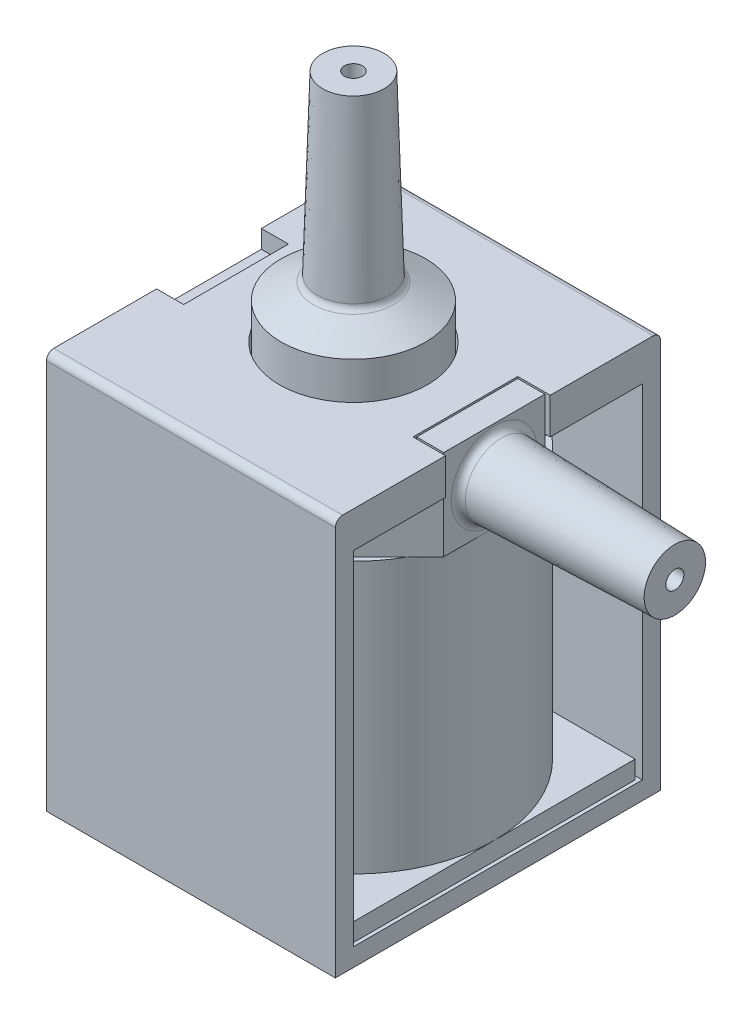
from build123d import *

# Parameters (mm, degrees)
SKETCH_1_W          = 16
SKETCH_1_H          = 18
EXTRUDE_1_DEPTH     = 1
SKETCH_2_W          = 15.6
SKETCH_2_H          = 15.6
EXTRUDE_2_DEPTH     = 1
SKETCH_3_R          = 7.8
EXTRUDE_3_DEPTH     = 15
EXTRUDE_4_DEPTH     = 3
SKETCH_5_R          = 4
EXTRUDE_5_DEPTH     = 4
SKETCH_7_R          = 0.5
CUT_EXTRUDE_1_DEPTH = 15
SKETCH_8_W          = 1.5
SKETCH_8_H          = 5.6
EXTRUDE_6_DEPTH     = 2
SKETCH_9_R          = 2
SKETCH_10_R         = 1.7
SKETCH_11_R         = 0.5
CUT_EXTRUDE_2_DEPTH = 11
SKETCH_12_W         = 16
SKETCH_12_H         = 1
EXTRUDE_7_DEPTH     = 19
SKETCH_13_R         = 4.1
EXTRUDE_8_DEPTH     = 2
SKETCH_14_W         = 1.5
SKETCH_14_H         = 5.8
CUT_EXTRUDE_3_DEPTH = 1
FILLET_1_R          = 0.4
FILLET_2_R          = 0.4


with BuildPart() as part:
    # 草图1 → 凸台-拉伸1 (new body)
    with BuildSketch(Plane(origin=(0, 0, 0), x_dir=(1, 0, 0), z_dir=(0, 1, 0))):
        Rectangle(SKETCH_1_W, SKETCH_1_H)
    extrude(amount=EXTRUDE_1_DEPTH)

    # 草图2 → 凸台-拉伸2 (add)
    with BuildSketch(Plane(origin=(0, 1, 0), x_dir=(1, 0, 0), z_dir=(0, 1, 0))):
        Rectangle(SKETCH_2_W, SKETCH_2_H)
    extrude(amount=EXTRUDE_2_DEPTH)

    # 草图3 → 凸台-拉伸3 (add)
    with BuildSketch(Plane(origin=(0, 2, 0), x_dir=(1, 0, 0), z_dir=(0, 1, 0))):
        with Locations(Location((0, 0, 0), (0, 0, 270))):
            Circle(SKETCH_3_R)
    extrude(amount=EXTRUDE_3_DEPTH)

    # 草图4 → 凸台-拉伸4 (add)
    with BuildSketch(Plane(origin=(0, 17, 0), x_dir=(1, 0, 0), z_dir=(0, 1, 0))):
        Polygon((-4.8, 7.8), (4.8, 7.8), (4.8, 5.8), (7.8, 2.8), (7.8, -2.8), (4.8, -5.8), (4.8, -7.8), (-4.8, -7.8), (-4.8, -5.8), (-7.8, -2.8), (-7.8, 2.8), (-4.8, 5.8), align=None)
    extrude(amount=EXTRUDE_4_DEPTH)

    # 草图5 → 凸台-拉伸5 (add)
    with BuildSketch(Plane(origin=(0, 20, 0), x_dir=(1, 0, 0), z_dir=(0, 1, 0))):
        with Locations(Location((0, 0, 0), (0, 0, 90))):
            Circle(SKETCH_5_R)
    extrude(amount=EXTRUDE_5_DEPTH)

    # 草图6 → 旋转1 (revolve)
    with BuildSketch(Plane.XY, mode=Mode.PRIVATE) as revolve_1_sk:
        Polygon((0, 24), (4, 24), (2, 25), (1.7, 35), (0, 35), align=None)
    revolve(revolve_1_sk.sketch.rotate(Axis((0, 35, 0), (0, -1, 0)), 270), axis=Axis((0, 35, 0), (0, -1, 0)))

    # 草图7 → 切除-拉伸1 (cut)
    with BuildSketch(Plane(origin=(0, 35, 0), x_dir=(1, 0, 0), z_dir=(0, 1, 0))):
        with Locations(Location((0, 0, 0), (0, 0, 180))):
            Circle(SKETCH_7_R)
    extrude(amount=-CUT_EXTRUDE_1_DEPTH, mode=Mode.SUBTRACT)

    # 草图8 → 凸台-拉伸6 (add)
    with BuildSketch(Plane(origin=(0, 20, 0), x_dir=(1, 0, 0), z_dir=(0, 1, 0))):
        with Locations((7.05, 0)):
            Rectangle(SKETCH_8_W, SKETCH_8_H)
    extrude(amount=EXTRUDE_6_DEPTH)

    # 草图9 → 放样1 section 0
    with BuildSketch(Plane(origin=(7.8, 0, 0), x_dir=(0, 0, -1), z_dir=(1, 0, 0))):
        with Locations((0, 19.5)):
            Circle(SKETCH_9_R)
    # 草图10 → 放样1 section 1
    with BuildSketch(Plane(origin=(17.8, 0, 0), x_dir=(0, 0, -1), z_dir=(1, 0, 0))):
        with Locations((0, 19.5)):
            Circle(SKETCH_10_R)
    loft()

    # 草图11 → 切除-拉伸2 (cut)
    with BuildSketch(Plane(origin=(17.8, 0, 0), x_dir=(0, 0, -1), z_dir=(1, 0, 0))):
        with Locations((0, 19.5)):
            Circle(SKETCH_11_R)
    extrude(amount=-CUT_EXTRUDE_2_DEPTH, mode=Mode.SUBTRACT)

    # 草图12 → 凸台-拉伸7 (add)
    with BuildSketch(Plane(origin=(0, 1, 0), x_dir=(1, 0, 0), z_dir=(0, 1, 0))):
        with Locations((0, 8.5)):
            Rectangle(SKETCH_12_W, SKETCH_12_H)
        with Locations((0, -8.5)):
            Rectangle(SKETCH_12_W, SKETCH_12_H)
    extrude(amount=EXTRUDE_7_DEPTH)

    # 草图13 → 凸台-拉伸8 (add)
    with BuildSketch(Plane(origin=(0, 20, 0), x_dir=(1, 0, 0), z_dir=(0, 1, 0))):
        Polygon((8, 2.9), (6.2, 2.9), (6.2, -2.9), (8, -2.9), (8, -9), (-8, -9), (-8, 9), (8, 9), align=None)
        with Locations(Location((0, 0, 0), (0, 0, 270))):
            Circle(SKETCH_13_R, mode=Mode.SUBTRACT)
    extrude(amount=EXTRUDE_8_DEPTH)

    # 草图14 → 切除-拉伸3 (cut)
    with BuildSketch(Plane(origin=(0, 22, 0), x_dir=(1, 0, 0), z_dir=(0, 1, 0))):
        with Locations((-7.25, 0)):
            Rectangle(SKETCH_14_W, SKETCH_14_H)
    extrude(amount=-CUT_EXTRUDE_3_DEPTH, mode=Mode.SUBTRACT)

    # 圆角1
    fillet_1_edges = [part.edges().sort_by_distance(p)[0] for p in [
        (7.8, 19.5, 2),
        (0, 25, 2),
    ]]
    fillet(fillet_1_edges, radius=FILLET_1_R)

    # 圆角2
    fillet_2_edges = [part.edges().sort_by_distance(p)[0] for p in [
        (0, 22, 9),
        (0, 22, -9),
    ]]
    fillet(fillet_2_edges, radius=FILLET_2_R)


solid = part.part
